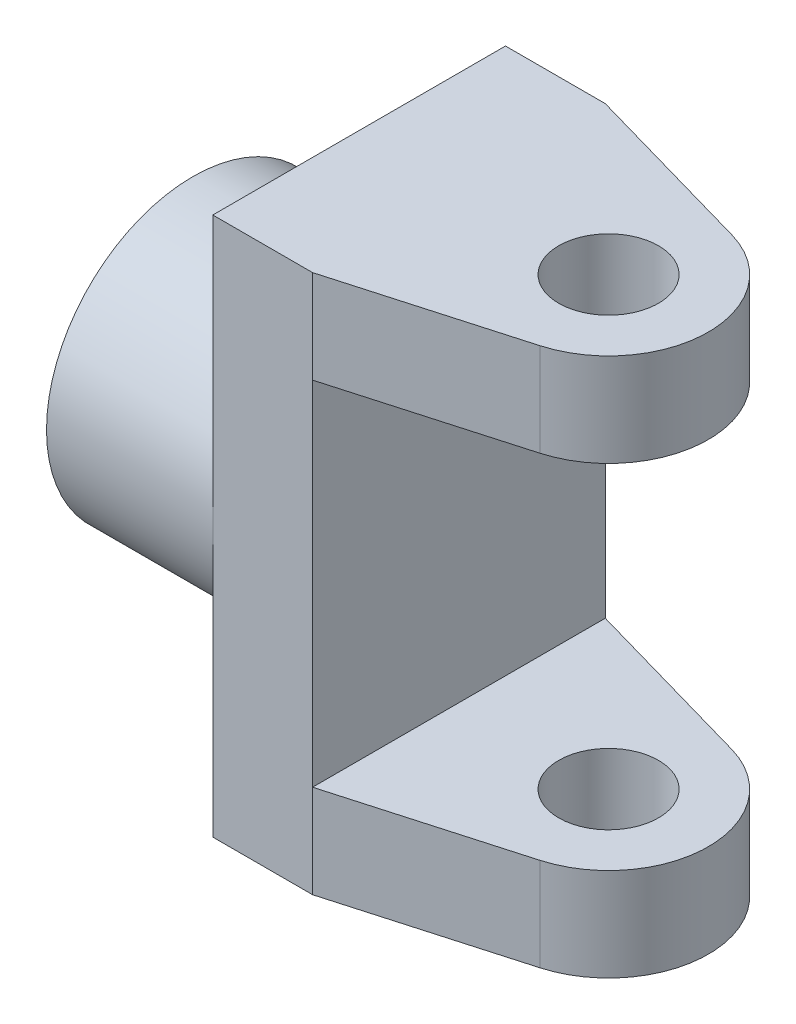
from build123d import *

# Parameters (mm, degrees)
BOSS_EXTRUDE1_DEPTH = 88
CUT_EXTRUDE1_DEPTH  = 227.934618696
SKETCH3_R           = 15
CUT_EXTRUDE2_DEPTH  = 227.934618696
SKETCH4_R           = 44
BOSS_EXTRUDE3_DEPTH = 50
SCALE1_SCALE        = 0.3


with BuildPart() as part:
    # Sketch1 → Boss-Extrude1 (new body)
    with BuildSketch(Plane.XY):
        Polygon((27.330348609, 81.508634223), (27.330348609, 59.807321306), (27.330348609, -59.807321306), (27.330348609, -80.491365777), (57.330348609, -80.491365777), (132.330348609, -80.491365777), (132.330348609, -52.491365777), (57.330348609, -52.491365777), (57.330348609, 53.508634223), (132.330348609, 53.508634223), (132.330348609, 81.508634223), (57.330348609, 81.508634223), align=None)
    extrude(amount=BOSS_EXTRUDE1_DEPTH)

    # Sketch2 → Cut-Extrude1 (cut, through all)
    with BuildSketch(Plane(origin=(0, 81.508634223, 0), x_dir=(1, 0, 0), z_dir=(0, 1, 0))):
        with BuildLine():
            Line((132.330348609, 0), (57.330348609, 0))
            Line((57.330348609, 0), (110.543103545, -15.146046088))
            ThreePointArc((110.543103545, -15.146046088), (126.271763021, -25.922149576), (132.330348609, -44))
            Line((132.330348609, -44), (132.330348609, 0))
        make_face()
        with BuildLine():
            Line((132.330348609, -88), (132.330348609, -44))
            ThreePointArc((132.330348609, -44), (126.271763021, -62.077850424), (110.543103545, -72.853953912))
            Line((110.543103545, -72.853953912), (57.330348609, -88))
            Line((57.330348609, -88), (132.330348609, -88))
        make_face()
    extrude(amount=-CUT_EXTRUDE1_DEPTH, mode=Mode.SUBTRACT)

    # Sketch3 → Cut-Extrude2 (cut, through all)
    with BuildSketch(Plane(origin=(0, 81.508634223, 0), x_dir=(1, 0, 0), z_dir=(0, 1, 0))):
        with Locations(Location((102.330348609, -44, 0), (0, 0, 180))):
            Circle(SKETCH3_R)
    extrude(amount=-CUT_EXTRUDE2_DEPTH, mode=Mode.SUBTRACT)

    # Sketch4 → Boss-Extrude3 (add)
    with BuildSketch(Plane.ZY.offset(-27.330348609)):
        with Locations((44, 0.508634223)):
            Circle(SKETCH4_R)
        with BuildLine():
            Line((24.404082058, 4.508634223), (20.404082058, 4.508634223))
            Line((20.404082058, 4.508634223), (20.404082058, -3.491365777))
            Line((20.404082058, -3.491365777), (24.404082058, -3.491365777))
            ThreePointArc((24.404082058, -3.491365777), (64, 0.508634223), (24.404082058, 4.508634223))
        make_face(mode=Mode.SUBTRACT)
    extrude(amount=BOSS_EXTRUDE3_DEPTH)


with BuildPart() as part_1:
    # Scale1: scaled about (43.08652806, 0.508634223, 44.036146931)
    add(part.part.scale(SCALE1_SCALE).moved(Location((30.160569642, 0.356043956, 30.825302852))))


solid = part_1.part
